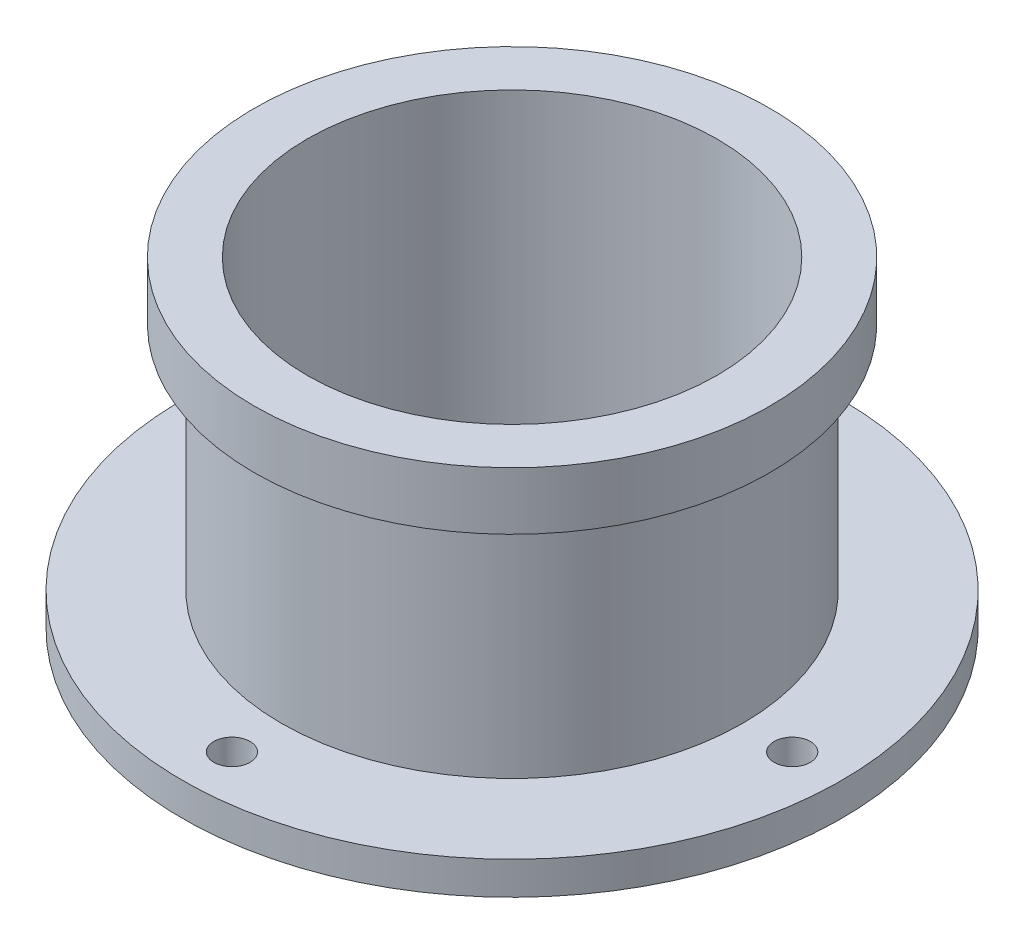
from build123d import *

# Parameters (mm, degrees)
SKETCH1_R           = 39.125
BOSS_EXTRUDE1_DEPTH = 8.75
SKETCH4_R           = 31.083201595
CUT_EXTRUDE1_DEPTH  = 9
BOSS_EXTRUDE3_START = 40
SKETCH5_R           = 35
SKETCH5_R_2         = 31.083201595
BOSS_EXTRUDE3_DEPTH = 40
SKETCH8_R           = 50
BOSS_EXTRUDE4_DEPTH = 5
SKETCH10_R          = 2.75
CUT_EXTRUDE2_DEPTH  = 5
CUT_EXTRUDE3_START  = -5
SKETCH11_R          = 31.083201595
CUT_EXTRUDE3_DEPTH  = 5


with BuildPart() as part:
    # Sketch1 → Boss-Extrude1 (new body)
    with BuildSketch(Plane(origin=(0, 0, 0), x_dir=(1, 0, 0), z_dir=(0, 1, 0))):
        with Locations(Location((0, 0, 0), (0, 0, 270))):
            Circle(SKETCH1_R)
    extrude(amount=BOSS_EXTRUDE1_DEPTH)

    # Sketch4 → Cut-Extrude1 (cut)
    with BuildSketch(Plane.XZ):
        with Locations(Location((0, 0, 0), (0, 0, 270))):
            Circle(SKETCH4_R)
    extrude(amount=-CUT_EXTRUDE1_DEPTH, mode=Mode.SUBTRACT)

    # Sketch5 → Boss-Extrude3 (add)
    with BuildSketch(Plane.XZ.offset(BOSS_EXTRUDE3_START)):
        with Locations(Location((0, 0, 0), (0, 0, 270))):
            Circle(SKETCH5_R)
        with Locations(Location((0, 0, 0), (0, 0, 270))):
            Circle(SKETCH5_R_2, mode=Mode.SUBTRACT)
    extrude(amount=-BOSS_EXTRUDE3_DEPTH)

    # Sketch8 → Boss-Extrude4 (add)
    with BuildSketch(Plane.XZ.offset(40)):
        with Locations(Location((0, 0, 0), (0, 0, 270))):
            Circle(SKETCH8_R)
    extrude(amount=-BOSS_EXTRUDE4_DEPTH)

    # Sketch10 → Cut-Extrude2 (cut)
    with BuildSketch(Plane(origin=(0, -35, 0), x_dir=(1, 0, 0), z_dir=(0, 1, 0))):
        with Locations(Location((0, 42.5, 0), (0, 0, 270))):
            Circle(SKETCH10_R)
        with Locations(Location((42.5, 0, 0), (0, 0, 270))):
            Circle(SKETCH10_R)
        with Locations(Location((0, -42.5, 0), (0, 0, 270))):
            Circle(SKETCH10_R)
        with Locations(Location((-42.5, 0, 0), (0, 0, 270))):
            Circle(SKETCH10_R)
    extrude(amount=-CUT_EXTRUDE2_DEPTH, mode=Mode.SUBTRACT)

    # Sketch11 → Cut-Extrude3 (cut)
    with BuildSketch(Plane(origin=(0, -35, 0), x_dir=(1, 0, 0), z_dir=(0, 1, 0)).offset(CUT_EXTRUDE3_START)):
        with Locations(Location((0, 0, 0), (0, 0, 270))):
            Circle(SKETCH11_R)
    extrude(amount=CUT_EXTRUDE3_DEPTH, mode=Mode.SUBTRACT)


solid = part.part
